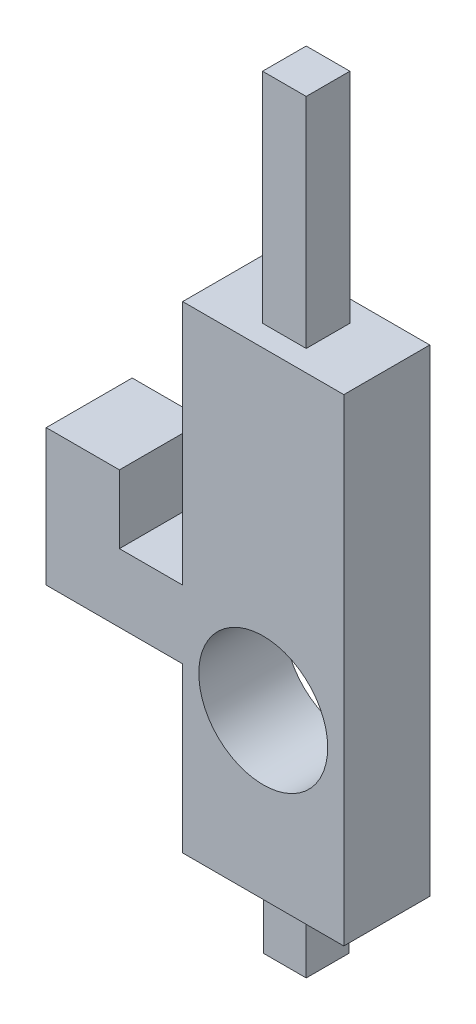
from build123d import *

# Parameters (mm, degrees)
SKETCH1_W           = 3.959797974
SKETCH1_H           = 3.959797974
BOSS_EXTRUDE1_DEPTH = 6.35
SKETCH2_W           = 15
SKETCH2_H           = 8
BOSS_EXTRUDE2_DEPTH = 44.45
SKETCH3_R           = 6
CUT_EXTRUDE1_DEPTH  = 25.4
SKETCH4_W           = 4.064
SKETCH4_H           = 4.064
BOSS_EXTRUDE3_DEPTH = 20.32
SKETCH5_W           = 8
SKETCH5_H           = 6.35
BOSS_EXTRUDE4_DEPTH = 12.7
SKETCH6_W           = 6.812329396
SKETCH6_H           = 8
BOSS_EXTRUDE5_DEPTH = 6.35


with BuildPart() as part:
    # Sketch1 → Boss-Extrude1 (new body)
    with BuildSketch(Plane(origin=(0, 0, 0), x_dir=(1, 0, 0), z_dir=(0, 1, 0))):
        Rectangle(SKETCH1_W, SKETCH1_H)
    extrude(amount=BOSS_EXTRUDE1_DEPTH)

    # Sketch2 → Boss-Extrude2 (add)
    with BuildSketch(Plane(origin=(0, 6.35, 0), x_dir=(1, 0, 0), z_dir=(0, 1, 0))):
        Rectangle(SKETCH2_W, SKETCH2_H)
    extrude(amount=BOSS_EXTRUDE2_DEPTH)

    # Sketch3 → Cut-Extrude1 (cut)
    with BuildSketch(Plane.XY.offset(4)):
        with Locations((0, 21.59)):
            Circle(SKETCH3_R)
    extrude(amount=-CUT_EXTRUDE1_DEPTH, mode=Mode.SUBTRACT)

    # Sketch4 → Boss-Extrude3 (add)
    with BuildSketch(Plane(origin=(0, 50.8, 0), x_dir=(1, 0, 0), z_dir=(0, 1, 0))):
        Rectangle(SKETCH4_W, SKETCH4_H)
    extrude(amount=BOSS_EXTRUDE3_DEPTH)

    # Sketch5 → Boss-Extrude4 (add)
    with BuildSketch(Plane.ZY.offset(7.5)):
        with Locations((0, 24.765)):
            Rectangle(SKETCH5_W, SKETCH5_H)
    extrude(amount=BOSS_EXTRUDE4_DEPTH)

    # Sketch6 → Boss-Extrude5 (add)
    with BuildSketch(Plane(origin=(0, 27.94, 0), x_dir=(1, 0, 0), z_dir=(0, 1, 0))):
        with Locations((-16.793835302, 0)):
            Rectangle(SKETCH6_W, SKETCH6_H)
    extrude(amount=BOSS_EXTRUDE5_DEPTH)


solid = part.part
